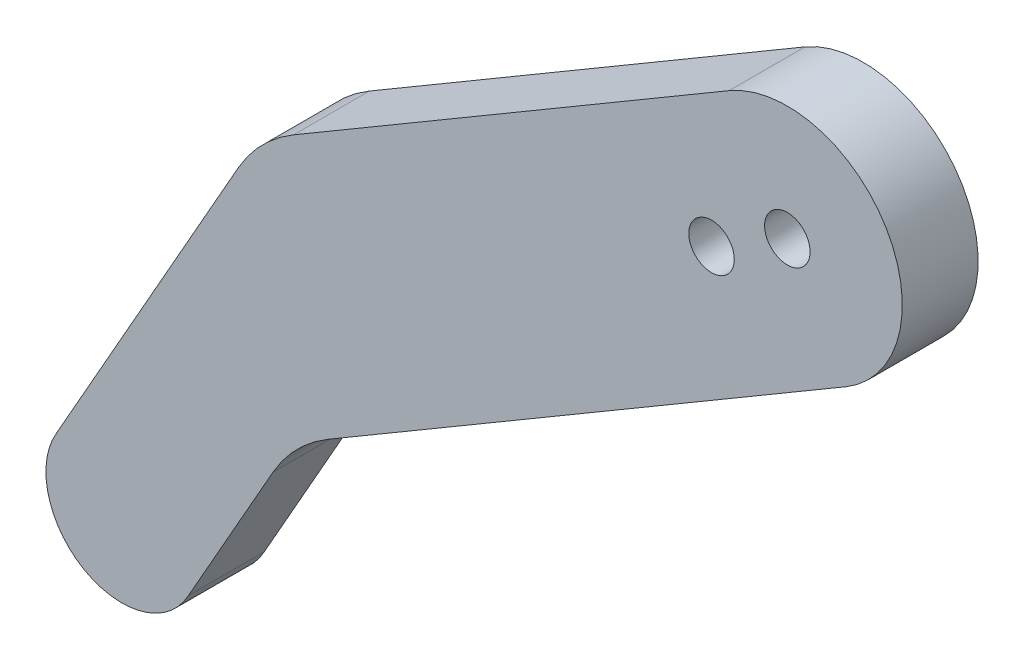
from build123d import *

# Parameters (mm, degrees)
BOSS_EXTRUDE1_DEPTH = 5
SKETCH4_R           = 1.5
CUT_EXTRUDE1_DEPTH  = 7


with BuildPart() as part:
    # Sketch3 → Boss-Extrude1 (new body)
    with BuildSketch(Plane.XY):
        with BuildLine():
            Line((0, 0), (11.994786333, 21.156847919))
            ThreePointArc((11.994786333, 21.156847919), (13.567689845, 23.24030881), (15.626237328, 24.845680108))
            Line((15.626237328, 24.845680108), (44.351167277, 41.731610874))
            ThreePointArc((44.351167277, 41.731610874), (54.727243082, 39.03834109), (52.033973298, 28.662265284))
            Line((52.033973298, 28.662265284), (17.913864572, 8.604782301))
            ThreePointArc((17.913864572, 8.604782301), (15.855317089, 6.999411003), (14.282413577, 4.915950112))
            Line((14.282413577, 4.915950112), (8.699180072, -4.931963714))
            ThreePointArc((8.699180072, -4.931963714), (1.838948591, -6.894344126), (0, 0))
        make_face()
    extrude(amount=BOSS_EXTRUDE1_DEPTH)

    # Sketch4 → Cut-Extrude1 (cut)
    with BuildSketch(Plane.XY.offset(5)):
        with Locations((48.192570288, 35.196938079)):
            Circle(SKETCH4_R)
        with Locations((43.192570288, 32.257691439)):
            Circle(SKETCH4_R)
    extrude(amount=-CUT_EXTRUDE1_DEPTH, mode=Mode.SUBTRACT)


solid = part.part
